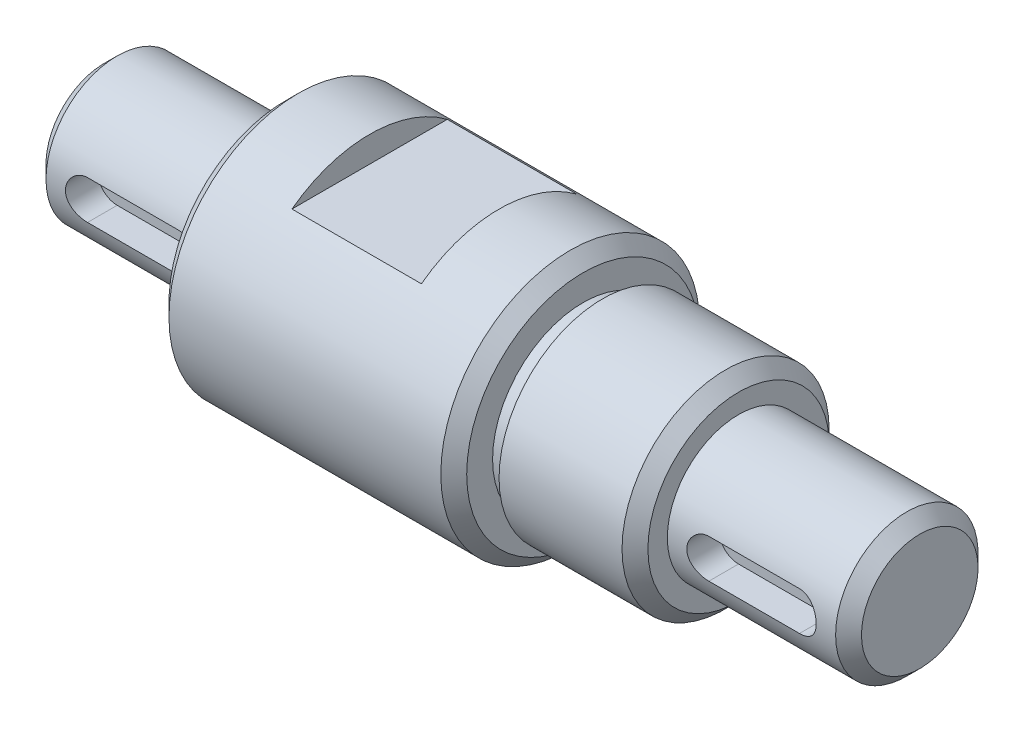
from build123d import *

# Parameters (mm, degrees)
CHAMFER1_SIZE           = 2
CUT_EXTRUDE1_DEPTH      = 130.135587659
CUT_EXTRUDE1_DEPTH_BACK = 130.135587659
SKETCH2_W               = 20
SKETCH2_H               = 6
CUT_EXTRUDE2_DEPTH      = 5


with BuildPart() as part:
    # Sketch1 → Revolve1 (revolve)
    with BuildSketch(Plane.XY, mode=Mode.PRIVATE) as revolve1_sk:
        Polygon((0, 0), (0, 11), (28, 11), (28, 20), (74, 20), (74, 14), (77, 14), (77, 16), (98, 16), (98, 11), (126, 11), (126, 0), align=None)
    revolve(revolve1_sk.sketch.rotate(Axis((0, 0, 0), (1, 0, 0)), 90), axis=Axis((0, 0, 0), (1, 0, 0)))

    # Chamfer1
    chamfer1_edges = [part.edges().sort_by_distance(p)[0] for p in [
        (98, 0, -16),
        (74, 0, -20),
        (28, 0, -20),
        (0, 0, -11),
        (126, 0, -11),
    ]]
    chamfer(chamfer1_edges, length=CHAMFER1_SIZE)

    # Sketch2 → Cut-Extrude1 (cut, two sides: drawn at the far end of the back side and taken through both)
    with BuildSketch(Plane.XY.offset(-CUT_EXTRUDE1_DEPTH_BACK)):
        with Locations((51, 19)):
            Rectangle(SKETCH2_W, SKETCH2_H)
    extrude(amount=CUT_EXTRUDE1_DEPTH + CUT_EXTRUDE1_DEPTH_BACK, mode=Mode.SUBTRACT)

    # Sketch3 → Cut-Extrude2 (cut)
    with BuildSketch(Plane.XY.offset(11)):
        with BuildLine():
            Line((8, 3), (22, 3))
            ThreePointArc((22, 3), (25, 0), (22, -3))
            Line((22, -3), (8, -3))
            ThreePointArc((8, -3), (5, 0), (8, 3))
        make_face()
        with BuildLine():
            Line((104, 3), (118, 3))
            ThreePointArc((118, 3), (121, 0), (118, -3))
            Line((118, -3), (104, -3))
            ThreePointArc((104, -3), (101, 0), (104, 3))
        make_face()
    extrude(amount=-CUT_EXTRUDE2_DEPTH, mode=Mode.SUBTRACT)


solid = part.part
